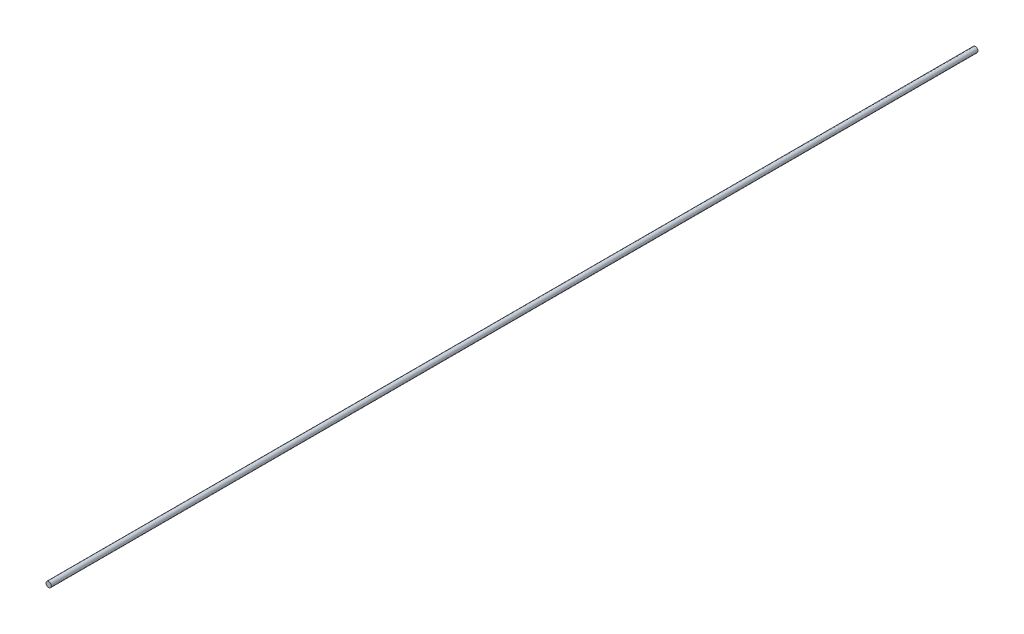
from build123d import *

# Parameters (mm, degrees)
SKETCH_1_R = 0.4
D0P8_DEPTH = 140.255436133


with BuildPart() as part:
    # 草图1 → D0p8钢索直线跨度 (new body)
    with BuildSketch(Plane.XY):
        Circle(SKETCH_1_R)
    extrude(amount=D0P8_DEPTH)


solid = part.part
